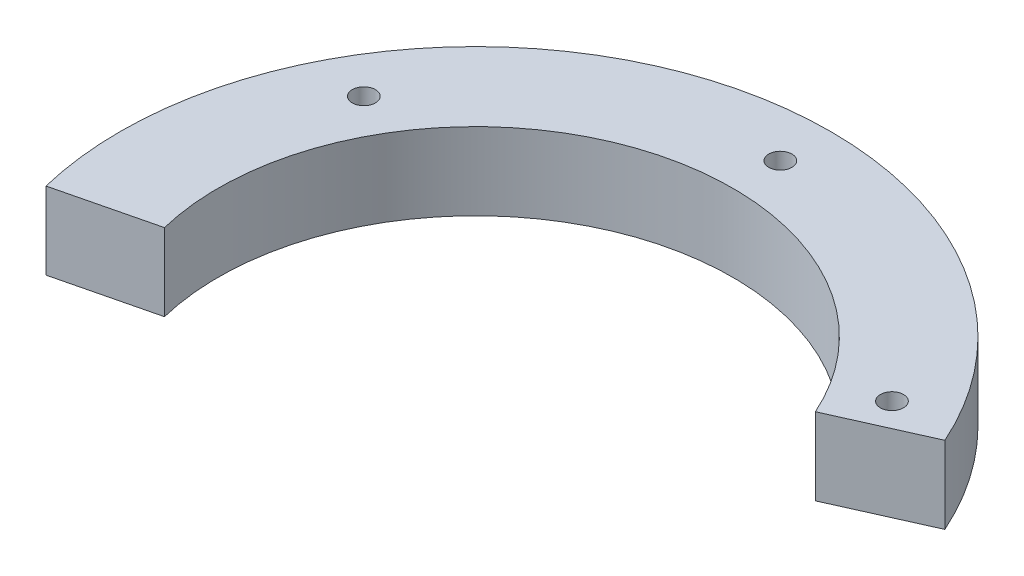
from build123d import *

# Parameters (mm, degrees)
SKETCH1_R           = 46.0375
SKETCH1_R_2         = 1.5
SKETCH1_R_3         = 33.3375
BOSS_EXTRUDE1_DEPTH = 10
CUT_EXTRUDE1_DEPTH  = 66.870348508


with BuildPart() as part:
    # Sketch1 → Boss-Extrude1 (new body)
    with BuildSketch(Plane(origin=(0, 0, 0), x_dir=(1, 0, 0), z_dir=(0, 1, 0))):
        with Locations(Location((0, 0, 0), (0, 0, 270))):
            Circle(SKETCH1_R)
        with Locations(Location((0, 39.5, 0), (0, 0, 270))):
            Circle(SKETCH1_R_2, mode=Mode.SUBTRACT)
        with Locations(Location((34.208003449, 19.75, 0), (0, 0, 270))):
            Circle(SKETCH1_R_2, mode=Mode.SUBTRACT)
        with Locations(Location((34.208003449, -19.75, 0), (0, 0, 270))):
            Circle(SKETCH1_R_2, mode=Mode.SUBTRACT)
        with Locations(Location((0, -39.5, 0), (0, 0, 270))):
            Circle(SKETCH1_R_2, mode=Mode.SUBTRACT)
        with Locations(Location((-34.208003449, -19.75, 0), (0, 0, 270))):
            Circle(SKETCH1_R_2, mode=Mode.SUBTRACT)
        with Locations(Location((-34.208003449, 19.75, 0), (0, 0, 270))):
            Circle(SKETCH1_R_2, mode=Mode.SUBTRACT)
        with Locations(Location((0, 0, 0), (0, 0, 270))):
            Circle(SKETCH1_R_3, mode=Mode.SUBTRACT)
    extrude(amount=BOSS_EXTRUDE1_DEPTH)

    # Sketch2 → Cut-Extrude1 (cut, through all)
    with BuildSketch(Plane(origin=(0, 10, 0), x_dir=(1, 0, 0), z_dir=(0, 1, 0))):
        with BuildLine():
            Line((0, 0), (-44.72616408, -10.909704529))
            ThreePointArc((-44.72616408, -10.909704529), (14.909439021, -43.556400613), (42.029747553, 18.787009525))
            Line((42.029747553, 18.787009525), (0, 0))
        make_face()
    extrude(amount=-CUT_EXTRUDE1_DEPTH, mode=Mode.SUBTRACT)


solid = part.part
